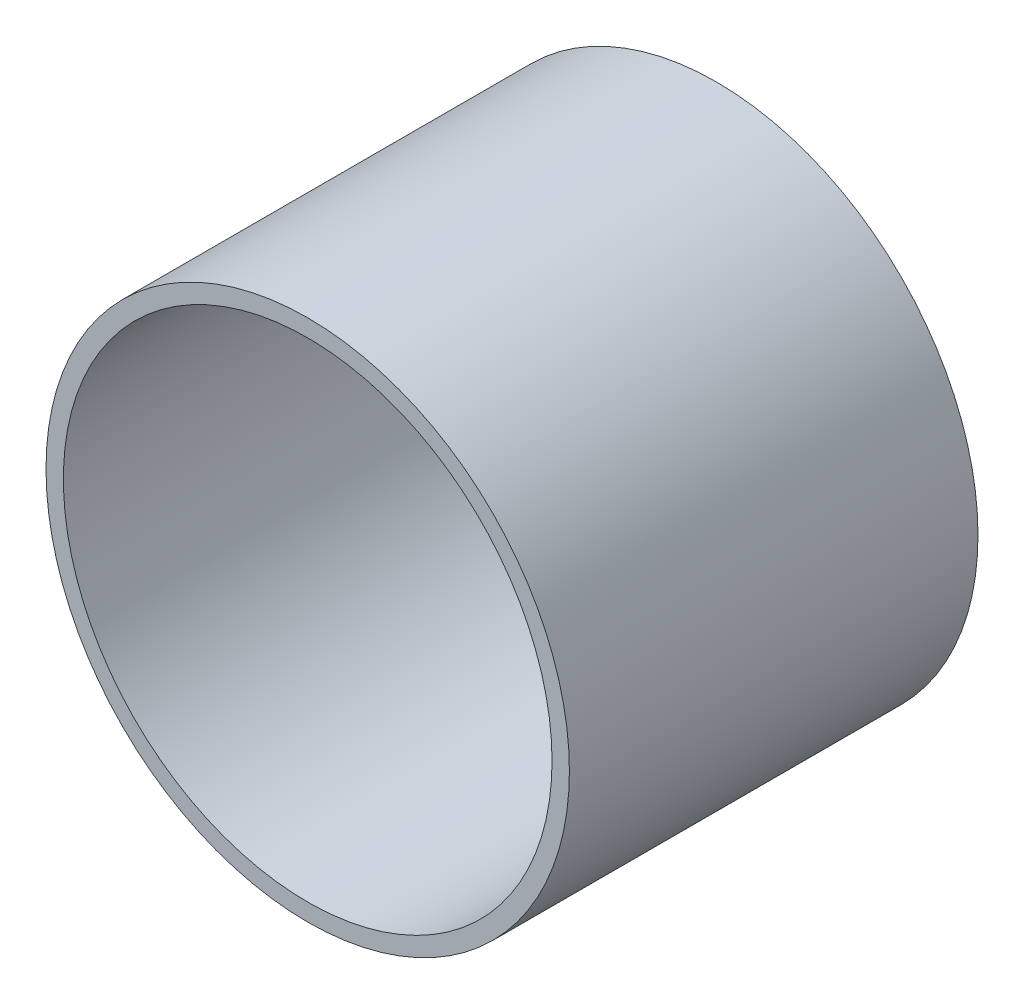
from build123d import *

# Parameters (mm, degrees)
SKETCH1_R           = 32.5374
SKETCH1_R_2         = 30.3784
BOSS_EXTRUDE1_DEPTH = 50.8


with BuildPart() as part:
    # Sketch1 → Boss-Extrude1 (new body)
    with BuildSketch(Plane.XY):
        Circle(SKETCH1_R)
        Circle(SKETCH1_R_2, mode=Mode.SUBTRACT)
    extrude(amount=BOSS_EXTRUDE1_DEPTH)


solid = part.part
